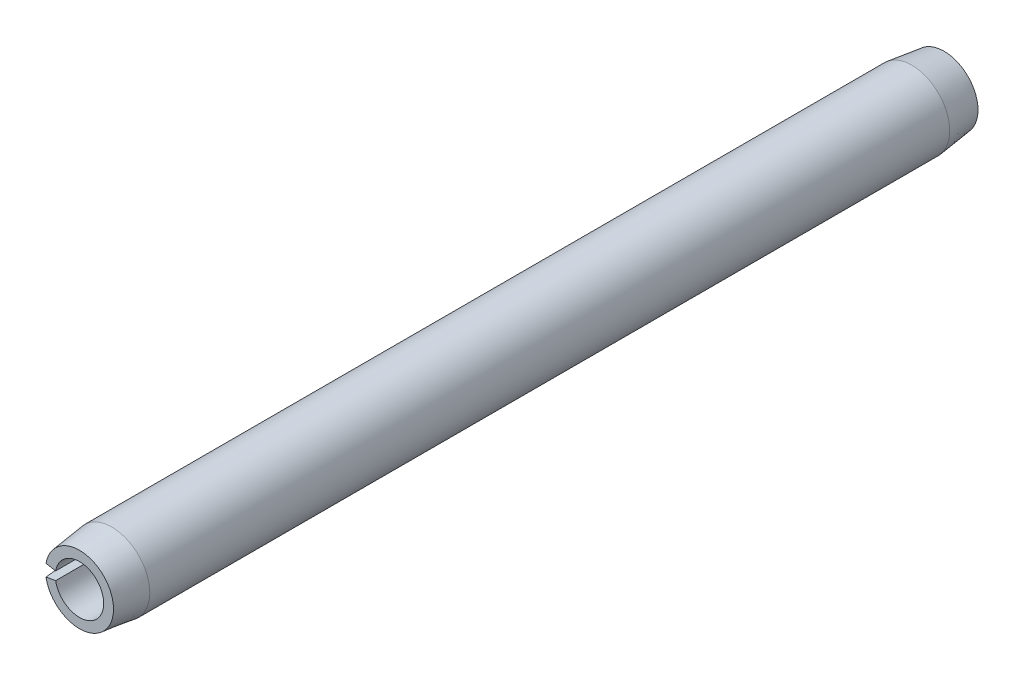
from build123d import *

# Parameters (mm, degrees)
EXTRUDE1_DEPTH = 9.525


with BuildPart() as part:
    # Sketch1 → Extrude1 (new, symmetric)
    with BuildSketch(Plane.XY):
        with BuildLine():
            Line((-0.825465859, 0.145551903), (-0.525296455, 0.092623938))
            ThreePointArc((-0.525296455, 0.092623938), (0.5334, 0), (-0.525296455, -0.092623938))
            Line((-0.525296455, -0.092623938), (-0.825465859, -0.145551903))
            ThreePointArc((-0.825465859, -0.145551903), (0.8382, 0), (-0.825465859, 0.145551903))
        make_face()
    extrude(amount=EXTRUDE1_DEPTH, both=True)

    # Sketch2 → Cut-Revolve1 (revolve, cut)
    with BuildSketch(Plane(origin=(0, 0, 0), x_dir=(0, 0, -1), z_dir=(1, 0, 0))):
        Polygon((9.525, 0.8382), (9.525, 0.7493), (8.8138, 0.8382), align=None)
        Polygon((-8.8138, 0.8382), (-9.525, 0.8382), (-9.525, 0.7493), align=None)
    revolve(axis=Axis((0, 0, -9.525), (0, 0, 1)), mode=Mode.SUBTRACT)


solid = part.part
